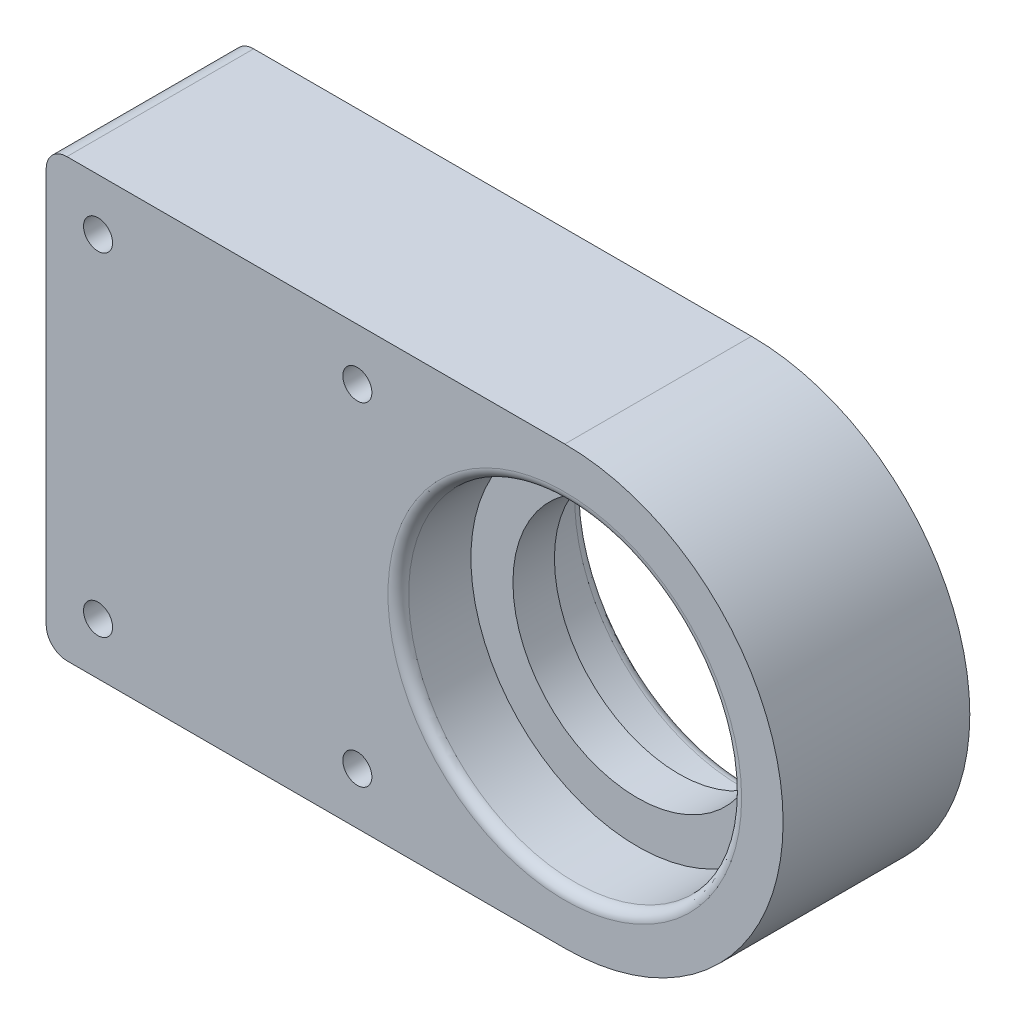
from build123d import *

# Parameters (mm, degrees)
BOSS_EXTRUDE1_DEPTH      = 9
BOSS_EXTRUDE1_DEPTH_BACK = 9
SKETCH1_R                = 16.05
BOSS_EXTRUDE2_DEPTH      = 2
BOSS_EXTRUDE2_DEPTH_BACK = 2
SKETCH2_R                = 12
SKETCH3_R                = 1.4
CUT_EXTRUDE1_DEPTH       = 58.158573285
FILLET1_R                = 2
FILLET2_R                = 1


with BuildPart() as part:
    # Sketch1 → Boss-Extrude1 (new, two sides: drawn at the far end of the back side and taken through both)
    with BuildSketch(Plane.XY.offset(-BOSS_EXTRUDE1_DEPTH_BACK)):
        with BuildLine():
            Line((0, 21.05), (-50, 21.05))
            Line((-50, 21.05), (-50, -21.05))
            Line((-50, -21.05), (0, -21.05))
            ThreePointArc((0, -21.05), (21.05, 0), (0, 21.05))
        make_face()
        Circle(SKETCH1_R, mode=Mode.SUBTRACT)
    extrude(amount=BOSS_EXTRUDE1_DEPTH + BOSS_EXTRUDE1_DEPTH_BACK)

    # Sketch2 → Boss-Extrude2 (add, two sides: drawn at the far end of the back side and taken through both)
    with BuildSketch(Plane(origin=(0, 0, 0), x_dir=(-1, 0, 0), z_dir=(0, 0, -1)).offset(-BOSS_EXTRUDE2_DEPTH_BACK)):
        with BuildLine():
            Line((0, -21.05), (50, -21.05))
            Line((50, -21.05), (50, 21.05))
            Line((50, 21.05), (0, 21.05))
            ThreePointArc((0, 21.05), (-21.05, 0), (0, -21.05))
        make_face()
        with Locations(Location((0, 0, 0), (0, 0, 180))):
            Circle(SKETCH2_R, mode=Mode.SUBTRACT)
    extrude(amount=BOSS_EXTRUDE2_DEPTH + BOSS_EXTRUDE2_DEPTH_BACK)

    # Sketch3 → Cut-Extrude1 (cut, through all)
    with BuildSketch(Plane.XY.offset(9)):
        with Locations((-45, 16.05)):
            Circle(SKETCH3_R)
        with Locations((-20, 16.05)):
            Circle(SKETCH3_R)
        with Locations((-20, -16.05)):
            Circle(SKETCH3_R)
        with Locations((-45, -16.05)):
            Circle(SKETCH3_R)
    extrude(amount=-CUT_EXTRUDE1_DEPTH, mode=Mode.SUBTRACT)

    # Fillet1
    fillet1_edges = [part.edges().sort_by_distance(p)[0] for p in [
        (-50, -21.05, 0),
        (-50, 21.05, 0),
    ]]
    fillet(fillet1_edges, radius=FILLET1_R)

    # Fillet2
    fillet2_edges = [part.edges().sort_by_distance(p)[0] for p in [
        (-16.05, 0, -9),
        (-16.05, 0, 9),
    ]]
    fillet(fillet2_edges, radius=FILLET2_R)


solid = part.part
